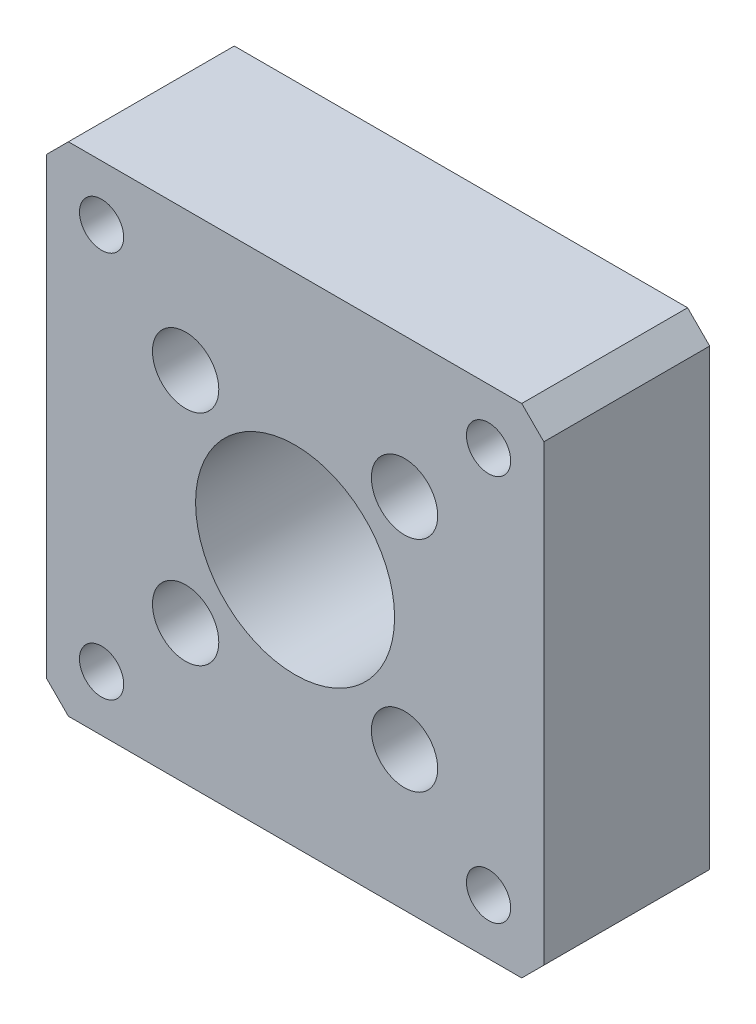
from build123d import *

# Parameters (mm, degrees)
SKETCH1_W           = 45
SKETCH1_H           = 45
SKETCH1_R           = 9
SKETCH1_R_2         = 2
BOSS_EXTRUDE1_DEPTH = 15
SKETCH2_R           = 1.65
CUT_EXTRUDE1_DEPTH  = 15
SKETCH3_R           = 3
CUT_EXTRUDE2_DEPTH  = 8
CHAMFER1_SIZE       = 2
SKETCH4_R           = 11.2
CUT_EXTRUDE3_DEPTH  = 2
ECHELLE1_SCALE      = 2
ECHELLE2_SCALE      = 0.25


with BuildPart() as part:
    # Sketch1 → Boss-Extrude1 (new body)
    with BuildSketch(Plane.XY):
        Rectangle(SKETCH1_W, SKETCH1_H)
        Circle(SKETCH1_R, mode=Mode.SUBTRACT)
        with Locations((-17.5, 17.5)):
            Circle(SKETCH1_R_2, mode=Mode.SUBTRACT)
        with Locations((17.5, 17.5)):
            Circle(SKETCH1_R_2, mode=Mode.SUBTRACT)
        with Locations((17.5, -17.5)):
            Circle(SKETCH1_R_2, mode=Mode.SUBTRACT)
        with Locations((-17.5, -17.5)):
            Circle(SKETCH1_R_2, mode=Mode.SUBTRACT)
    extrude(amount=BOSS_EXTRUDE1_DEPTH)

    # Sketch2 → Cut-Extrude1 (cut)
    with BuildSketch(Plane.XY.offset(15)):
        with Locations((9.899494937, 9.899494937)):
            Circle(SKETCH2_R)
        with Locations((9.899494937, -9.899494937)):
            Circle(SKETCH2_R)
        with Locations((-9.899494937, -9.899494937)):
            Circle(SKETCH2_R)
        with Locations((-9.899494937, 9.899494937)):
            Circle(SKETCH2_R)
    extrude(amount=-CUT_EXTRUDE1_DEPTH, mode=Mode.SUBTRACT)

    # Sketch3 → Cut-Extrude2 (cut)
    with BuildSketch(Plane.XY.offset(15)):
        with Locations((9.899494937, 9.899494937)):
            Circle(SKETCH3_R)
        with Locations((9.899494937, -9.899494937)):
            Circle(SKETCH3_R)
        with Locations((-9.899494937, -9.899494937)):
            Circle(SKETCH3_R)
        with Locations((-9.899494937, 9.899494937)):
            Circle(SKETCH3_R)
    extrude(amount=-CUT_EXTRUDE2_DEPTH, mode=Mode.SUBTRACT)

    # Chamfer1
    chamfer1_edges = [part.edges().sort_by_distance(p)[0] for p in [
        (22.5, -22.5, 7.5),
        (-22.5, -22.5, 7.5),
        (-22.5, 22.5, 7.5),
        (22.5, 22.5, 7.5),
    ]]
    chamfer(chamfer1_edges, length=CHAMFER1_SIZE)

    # Sketch4 → Cut-Extrude3 (cut)
    with BuildSketch(Plane(origin=(0, 0, 0), x_dir=(-1, 0, 0), z_dir=(0, 0, -1))):
        Circle(SKETCH4_R)
    extrude(amount=-CUT_EXTRUDE3_DEPTH, mode=Mode.SUBTRACT)


with BuildPart() as part_1:
    # Echelle1: scaled about (0, 0, 7.483766611)
    add(part.part.scale(ECHELLE1_SCALE).moved(Location((0, 0, -7.483766611))))


with BuildPart() as part_2:
    # Echelle2: scaled about (0, 0, 7.483766612)
    add(part_1.part.scale(ECHELLE2_SCALE).moved(Location((0, 0, 5.612824959))))


solid = part_2.part
